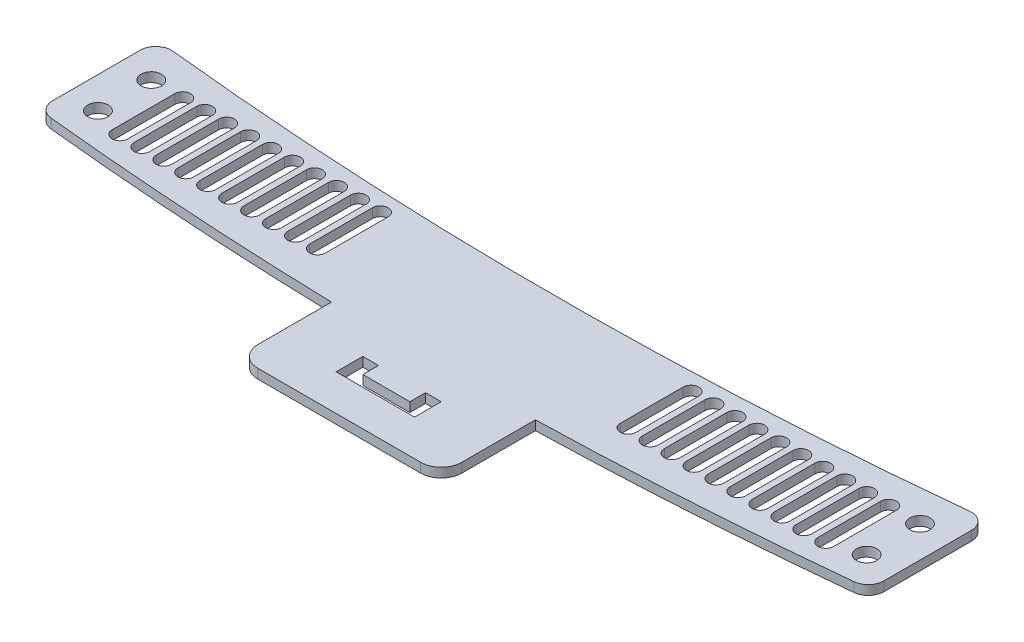
from build123d import *

# Parameters (mm, degrees)
SKETCH1_R           = 3.25
BOSS_EXTRUDE1_DEPTH = 3


with BuildPart() as part:
    # Sketch1 → Boss-Extrude1 (new body)
    with BuildSketch(Plane(origin=(0, 0, 0), x_dir=(1, 0, 0), z_dir=(0, 1, 0))):
        with BuildLine():
            Line((-10, 6.436614591), (-10, -21.493672684))
            ThreePointArc((-10, -21.493672684), (-8.711123408, -24.844428278), (-5.508974779, -26.467699692))
            ThreePointArc((-5.508974779, -26.467699692), (42.187344307, -30.432754781), (90, -32.579955692))
            Line((90, -32.579955692), (90, -56.029565828))
            ThreePointArc((90, -56.029565828), (91.918564772, -60.66139092), (96.550389863, -62.579955692))
            Line((96.550389863, -62.579955692), (148.449610137, -62.579955692))
            ThreePointArc((148.449610137, -62.579955692), (153.081435228, -60.66139092), (155, -56.029565828))
            Line((155, -56.029565828), (155, -32.579955692))
            ThreePointArc((155, -32.579955692), (202.812655693, -30.432754781), (250.508974779, -26.467699692))
            ThreePointArc((250.508974779, -26.467699692), (253.711123408, -24.844428278), (255, -21.493672684))
            Line((255, -21.493672684), (255, 6.436614591))
            ThreePointArc((255, 6.436614591), (253.346445742, 10.151624806), (249.479479641, 11.409446637))
            ThreePointArc((249.479479641, 11.409446637), (122.5, 4.781900515), (-4.479479641, 11.409446637))
            ThreePointArc((-4.479479641, 11.409446637), (-8.346445742, 10.151624806), (-10, 6.436614591))
        make_face()
        with Locations(Location((0, 0, 0), (0, 0, 270))):
            Circle(SKETCH1_R, mode=Mode.SUBTRACT)
        with Locations(Location((245, 0, 0), (0, 0, 270))):
            Circle(SKETCH1_R, mode=Mode.SUBTRACT)
        with Locations(Location((0, -17, 0), (0, 0, 270))):
            Circle(SKETCH1_R, mode=Mode.SUBTRACT)
        with Locations(Location((245, -17, 0), (0, 0, 270))):
            Circle(SKETCH1_R, mode=Mode.SUBTRACT)
        with BuildLine():
            Line((12.5, 0), (12.5, -20))
            ThreePointArc((12.5, -20), (10, -22.5), (7.5, -20))
            Line((7.5, -20), (7.5, 0))
            ThreePointArc((7.5, 0), (10, 2.5), (12.5, 0))
        make_face(mode=Mode.SUBTRACT)
        with BuildLine():
            Line((19.5, 0), (19.5, -20))
            ThreePointArc((19.5, -20), (17, -22.5), (14.5, -20))
            Line((14.5, -20), (14.5, 0))
            ThreePointArc((14.5, 0), (17, 2.5), (19.5, 0))
        make_face(mode=Mode.SUBTRACT)
        with BuildLine():
            Line((26.5, 0), (26.5, -20))
            ThreePointArc((26.5, -20), (24, -22.5), (21.5, -20))
            Line((21.5, -20), (21.5, 0))
            ThreePointArc((21.5, 0), (24, 2.5), (26.5, 0))
        make_face(mode=Mode.SUBTRACT)
        with BuildLine():
            Line((33.5, 0), (33.5, -20))
            ThreePointArc((33.5, -20), (31, -22.5), (28.5, -20))
            Line((28.5, -20), (28.5, 0))
            ThreePointArc((28.5, 0), (31, 2.5), (33.5, 0))
        make_face(mode=Mode.SUBTRACT)
        with BuildLine():
            Line((40.5, 0), (40.5, -20))
            ThreePointArc((40.5, -20), (38, -22.5), (35.5, -20))
            Line((35.5, -20), (35.5, 0))
            ThreePointArc((35.5, 0), (38, 2.5), (40.5, 0))
        make_face(mode=Mode.SUBTRACT)
        with BuildLine():
            Line((47.5, 0), (47.5, -20))
            ThreePointArc((47.5, -20), (45, -22.5), (42.5, -20))
            Line((42.5, -20), (42.5, 0))
            ThreePointArc((42.5, 0), (45, 2.5), (47.5, 0))
        make_face(mode=Mode.SUBTRACT)
        with BuildLine():
            Line((54.5, 0), (54.5, -20))
            ThreePointArc((54.5, -20), (52, -22.5), (49.5, -20))
            Line((49.5, -20), (49.5, 0))
            ThreePointArc((49.5, 0), (52, 2.5), (54.5, 0))
        make_face(mode=Mode.SUBTRACT)
        with BuildLine():
            Line((61.5, 0), (61.5, -20))
            ThreePointArc((61.5, -20), (59, -22.5), (56.5, -20))
            Line((56.5, -20), (56.5, 0))
            ThreePointArc((56.5, 0), (59, 2.5), (61.5, 0))
        make_face(mode=Mode.SUBTRACT)
        with BuildLine():
            Line((68.5, 0), (68.5, -20))
            ThreePointArc((68.5, -20), (66, -22.5), (63.5, -20))
            Line((63.5, -20), (63.5, 0))
            ThreePointArc((63.5, 0), (66, 2.5), (68.5, 0))
        make_face(mode=Mode.SUBTRACT)
        with BuildLine():
            Line((75.5, 0), (75.5, -20))
            ThreePointArc((75.5, -20), (73, -22.5), (70.5, -20))
            Line((70.5, -20), (70.5, 0))
            ThreePointArc((70.5, 0), (73, 2.5), (75.5, 0))
        make_face(mode=Mode.SUBTRACT)
        with BuildLine():
            Line((174.5, 0), (174.5, -20))
            ThreePointArc((174.5, -20), (172, -22.5), (169.5, -20))
            Line((169.5, -20), (169.5, 0))
            ThreePointArc((169.5, 0), (172, 2.5), (174.5, 0))
        make_face(mode=Mode.SUBTRACT)
        with BuildLine():
            Line((181.5, 0), (181.5, -20))
            ThreePointArc((181.5, -20), (179, -22.5), (176.5, -20))
            Line((176.5, -20), (176.5, 0))
            ThreePointArc((176.5, 0), (179, 2.5), (181.5, 0))
        make_face(mode=Mode.SUBTRACT)
        with BuildLine():
            Line((188.5, 0), (188.5, -20))
            ThreePointArc((188.5, -20), (186, -22.5), (183.5, -20))
            Line((183.5, -20), (183.5, 0))
            ThreePointArc((183.5, 0), (186, 2.5), (188.5, 0))
        make_face(mode=Mode.SUBTRACT)
        with BuildLine():
            Line((195.5, 0), (195.5, -20))
            ThreePointArc((195.5, -20), (193, -22.5), (190.5, -20))
            Line((190.5, -20), (190.5, 0))
            ThreePointArc((190.5, 0), (193, 2.5), (195.5, 0))
        make_face(mode=Mode.SUBTRACT)
        with BuildLine():
            Line((202.5, 0), (202.5, -20))
            ThreePointArc((202.5, -20), (200, -22.5), (197.5, -20))
            Line((197.5, -20), (197.5, 0))
            ThreePointArc((197.5, 0), (200, 2.5), (202.5, 0))
        make_face(mode=Mode.SUBTRACT)
        with BuildLine():
            Line((209.5, 0), (209.5, -20))
            ThreePointArc((209.5, -20), (207, -22.5), (204.5, -20))
            Line((204.5, -20), (204.5, 0))
            ThreePointArc((204.5, 0), (207, 2.5), (209.5, 0))
        make_face(mode=Mode.SUBTRACT)
        with BuildLine():
            Line((216.5, 0), (216.5, -20))
            ThreePointArc((216.5, -20), (214, -22.5), (211.5, -20))
            Line((211.5, -20), (211.5, 0))
            ThreePointArc((211.5, 0), (214, 2.5), (216.5, 0))
        make_face(mode=Mode.SUBTRACT)
        with BuildLine():
            Line((223.5, 0), (223.5, -20))
            ThreePointArc((223.5, -20), (221, -22.5), (218.5, -20))
            Line((218.5, -20), (218.5, 0))
            ThreePointArc((218.5, 0), (221, 2.5), (223.5, 0))
        make_face(mode=Mode.SUBTRACT)
        with BuildLine():
            Line((230.5, 0), (230.5, -20))
            ThreePointArc((230.5, -20), (228, -22.5), (225.5, -20))
            Line((225.5, -20), (225.5, 0))
            ThreePointArc((225.5, 0), (228, 2.5), (230.5, 0))
        make_face(mode=Mode.SUBTRACT)
        with BuildLine():
            Line((237.5, 0), (237.5, -20))
            ThreePointArc((237.5, -20), (235, -22.5), (232.5, -20))
            Line((232.5, -20), (232.5, 0))
            ThreePointArc((232.5, 0), (235, 2.5), (237.5, 0))
        make_face(mode=Mode.SUBTRACT)
        Polygon((115, -42.579955692), (115, -47.579955692), (130, -47.579955692), (130, -42.579955692), (135, -42.579955692), (135, -51.079955692), (110, -51.079955692), (110, -42.579955692), align=None, mode=Mode.SUBTRACT)
    extrude(amount=BOSS_EXTRUDE1_DEPTH)


solid = part.part
